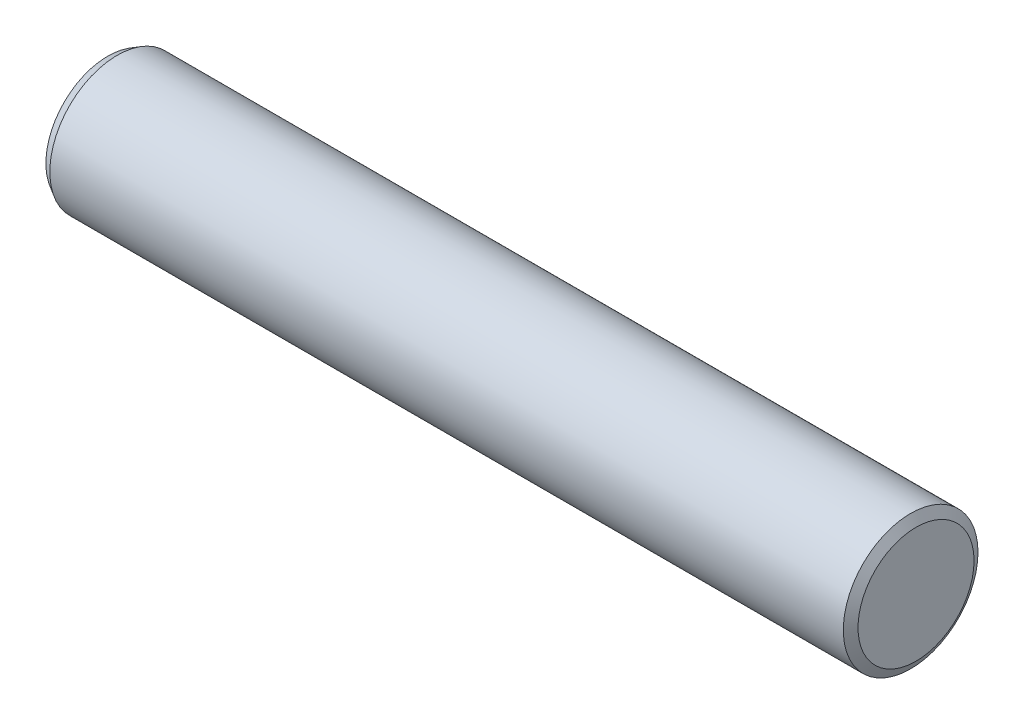
from build123d import *
from OCP.BRepFilletAPI import BRepFilletAPI_MakeChamfer

# Parameters (mm, degrees)
SKETCH1_W      = 30
SKETCH1_H      = 2.5
CHAMFER1_SIZE  = 0.2
CHAMFER1_SIZE2 = 0.346410162


with BuildPart() as part:
    # Sketch1 → Revolve1 (revolve)
    with BuildSketch(Plane.XY, mode=Mode.PRIVATE) as revolve1_sk:
        with Locations((-15, 1.25)):
            Rectangle(SKETCH1_W, SKETCH1_H)
    revolve(revolve1_sk.sketch.rotate(Axis((0, 0, 0), (-1, 0, 0)), 90), axis=Axis((0, 0, 0), (-1, 0, 0)))

    # Chamfer1: one chamfer whose edges measure the first distance from different faces: ONE call of the kernel's chamfer builder (chamfer() names one face for all edges)
    chamfer1_edges_1 = [part.edges().sort_by_distance(p)[0] for p in [
        (-30, 0, 2.5),
    ]]
    chamfer1_side_1 = [part.faces().sort_by_distance(p)[0] for p in [
        (-30, 0, 0),
    ]]
    chamfer1_edges_2 = [part.edges().sort_by_distance(p)[0] for p in [
        (0, 0, 2.5),
    ]]
    chamfer1_side_2 = [part.faces().sort_by_distance(p)[0] for p in [
        (-15, 0, 2.5),
    ]]
    chamfer1 = BRepFilletAPI_MakeChamfer(part.part.solid().wrapped)
    for e in chamfer1_edges_1:
        chamfer1.Add(CHAMFER1_SIZE, CHAMFER1_SIZE2, e.wrapped, chamfer1_side_1[0].wrapped)  # the first distance lies on this face
    for e in chamfer1_edges_2:
        chamfer1.Add(CHAMFER1_SIZE, CHAMFER1_SIZE2, e.wrapped, chamfer1_side_2[0].wrapped)  # the first distance lies on this face
    add(Compound.cast(chamfer1.Shape()), mode=Mode.REPLACE)


solid = part.part
